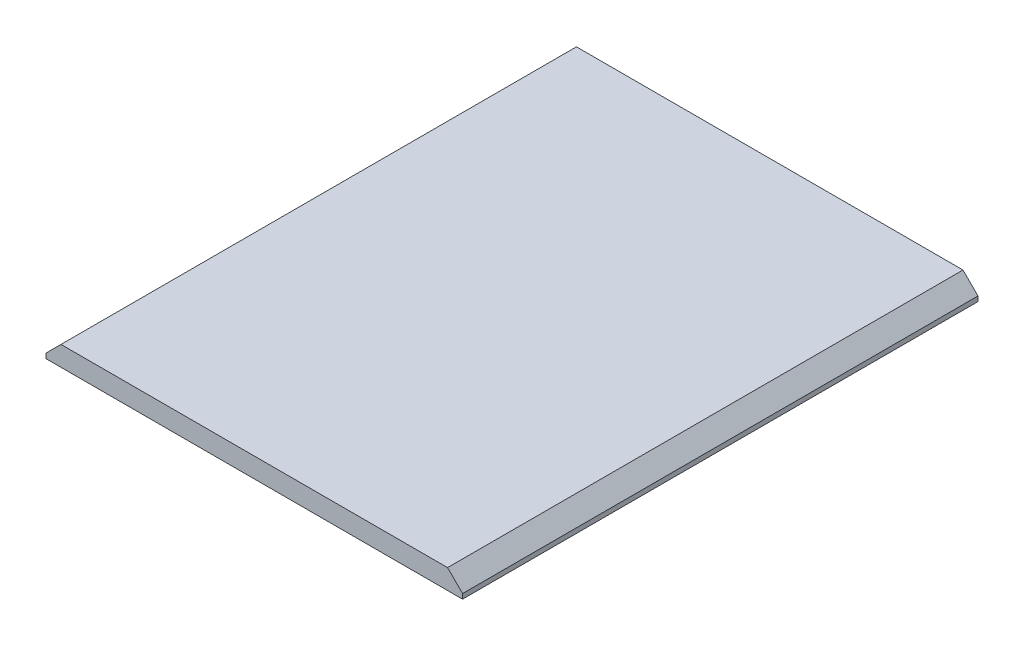
from build123d import *

# Parameters (mm, degrees)
SKETCH1_W           = 25.8
SKETCH1_H           = 2.65
BOSS_EXTRUDE1_DEPTH = 68.8


with BuildPart() as part:
    # Sketch1 → Boss-Extrude1 (new body)
    with BuildSketch(Plane.XY):
        Polygon((-2, 0.65), (-2, 0), (0, 0), (0, 2.65), align=None)
        with Locations((12.9, 1.325)):
            Rectangle(SKETCH1_W, SKETCH1_H)
    boss_extrude1 = extrude(amount=BOSS_EXTRUDE1_DEPTH)

    # Mirror1: Boss-Extrude1 across plane
    add(boss_extrude1.mirror(Plane(origin=(25.8, 0, 68.8), x_dir=(0, 0, 1), z_dir=(-1, 0, 0))))


solid = part.part
